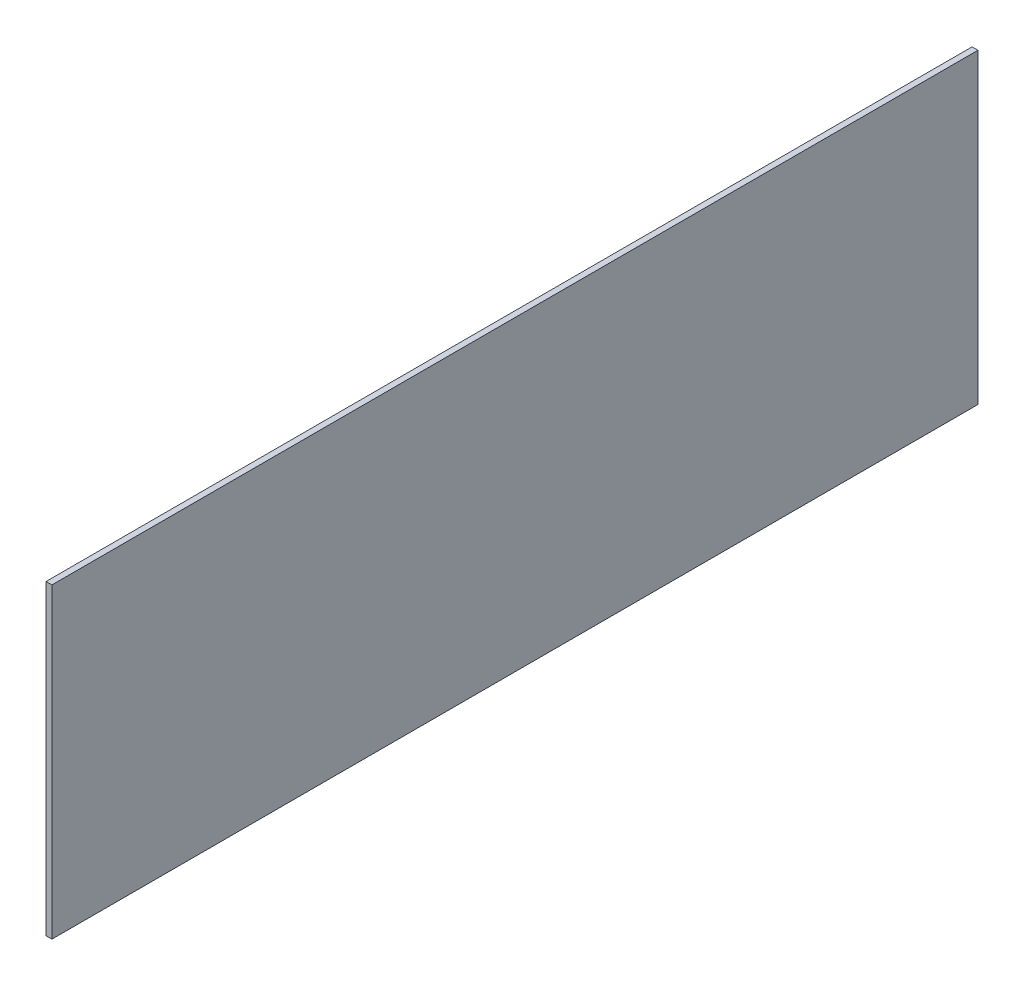
from build123d import *

# Parameters (mm, degrees)
SKETCH1_W           = 498.348
SKETCH1_H           = 165.1
BOSS_EXTRUDE1_DEPTH = 1.5875


with BuildPart() as part:
    # Sketch1 → Boss-Extrude1 (new, symmetric)
    with BuildSketch(Plane(origin=(0, 0, 0), x_dir=(0, 0, -1), z_dir=(1, 0, 0))):
        Rectangle(SKETCH1_W, SKETCH1_H)
    extrude(amount=BOSS_EXTRUDE1_DEPTH, both=True)


solid = part.part
